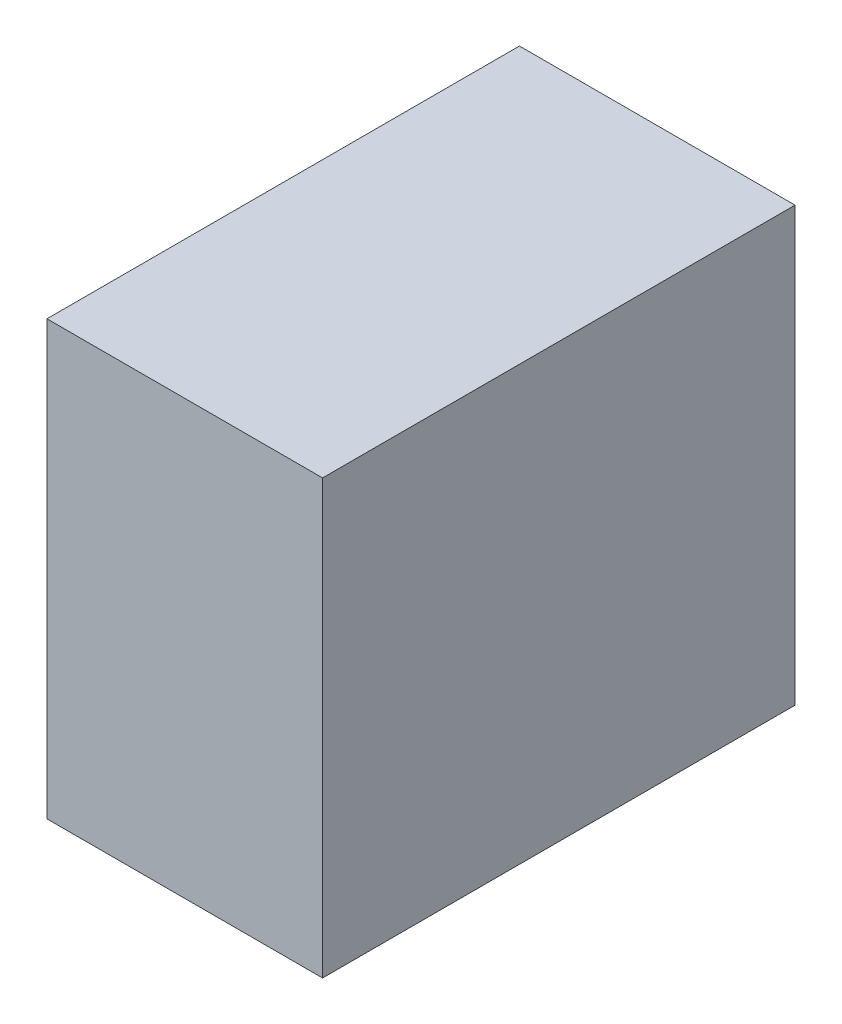
from build123d import *

# Parameters (mm, degrees)
SKETCH1_W           = 177.8
SKETCH1_H           = 279.4
BOSS_EXTRUDE1_DEPTH = 304.8


with BuildPart() as part:
    # Sketch1 → Boss-Extrude1 (new body)
    with BuildSketch(Plane.XY):
        Rectangle(SKETCH1_W, SKETCH1_H)
    extrude(amount=BOSS_EXTRUDE1_DEPTH)


solid = part.part
